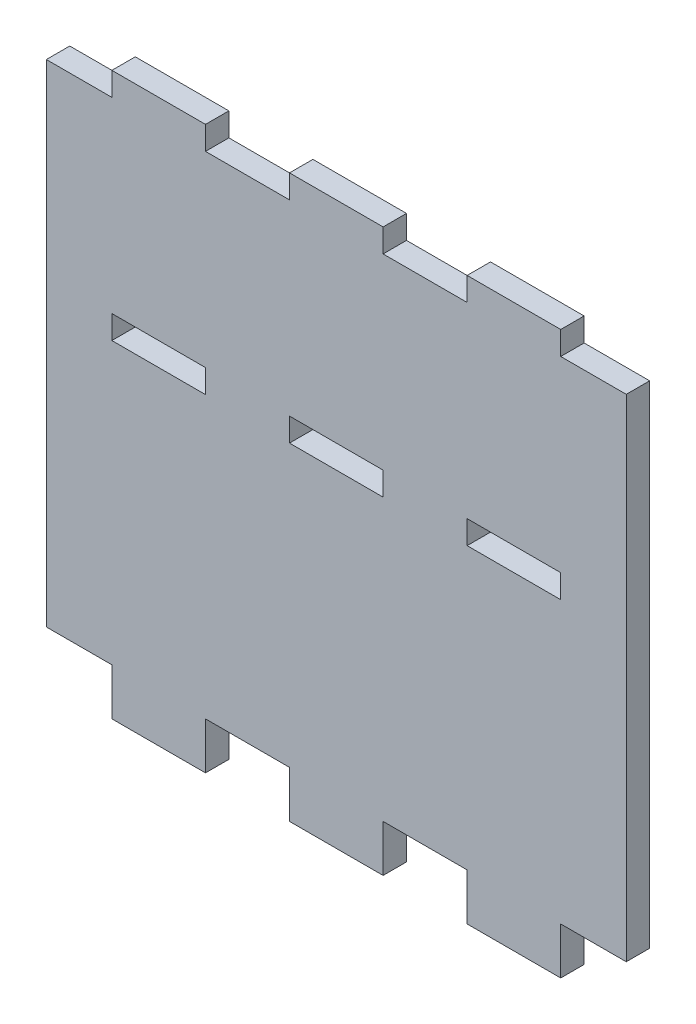
from build123d import *

# Parameters (mm, degrees)
SKETCH1_W           = 10
SKETCH1_H           = 2.5
BOSS_EXTRUDE1_DEPTH = 2.5


with BuildPart() as part:
    # Sketch1 → Boss-Extrude1 (new body)
    with BuildSketch(Plane.XY):
        Polygon((-23.975, 30), (-23.975, 27.5), (-30.975, 27.5), (-30.975, -25), (-23.975, -25), (-23.975, -30), (-13.975, -30), (-13.975, -25), (-5, -25), (-5, -30), (5, -30), (5, -25), (13.975, -25), (13.975, -30), (23.975, -30), (23.975, -25), (30.975, -25), (30.975, 27.5), (23.975, 27.5), (23.975, 30), (13.975, 30), (13.975, 27.5), (5, 27.5), (5, 30), (-5, 30), (-5, 27.5), (-13.975, 27.5), (-13.975, 30), align=None)
        with Locations((0, 6.25)):
            Rectangle(SKETCH1_W, SKETCH1_H, mode=Mode.SUBTRACT)
        with Locations((18.975, 6.25)):
            Rectangle(SKETCH1_W, SKETCH1_H, mode=Mode.SUBTRACT)
        with Locations((-18.975, 6.25)):
            Rectangle(SKETCH1_W, SKETCH1_H, mode=Mode.SUBTRACT)
    extrude(amount=BOSS_EXTRUDE1_DEPTH)


solid = part.part
